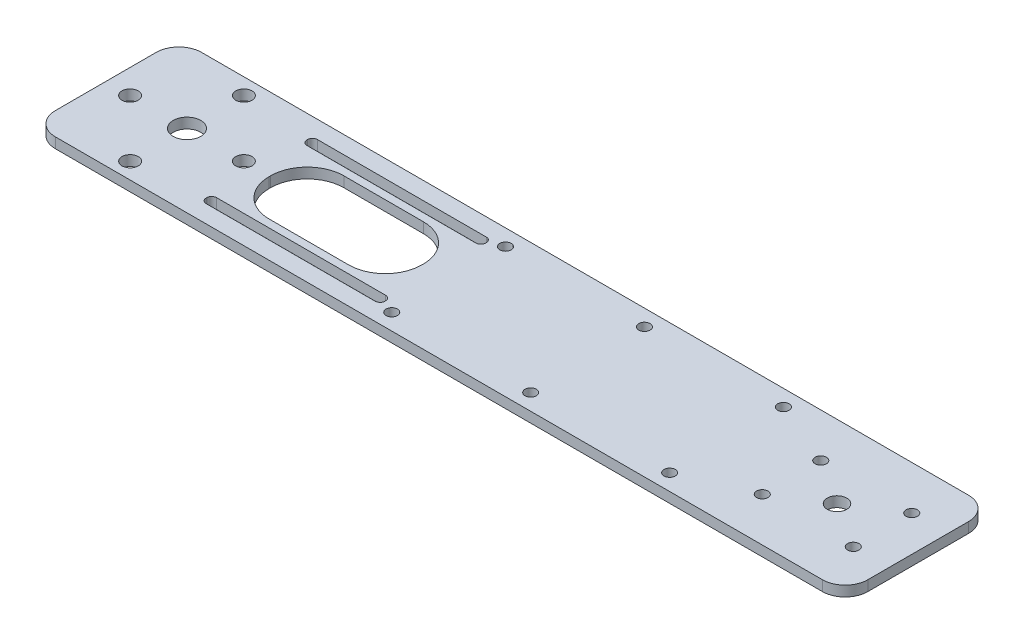
from build123d import *

# Parameters (mm, degrees)
SKETCH1_W           = 250
SKETCH1_H           = 45
BOSS_EXTRUDE1_DEPTH = 3.175
SKETCH4_R           = 3
SKETCH4_R_2         = 1.75
CUT_EXTRUDE1_DEPTH  = 227.144490592
SKETCH5_R           = 4.25
CUT_EXTRUDE2_DEPTH  = 227.144490592
SKETCH6_R           = 11.5
SKETCH6_R_2         = 1.5
CUT_EXTRUDE3_DEPTH  = 227.144490592
SKETCH10_R          = 1.75
CUT_EXTRUDE4_DEPTH  = 227.144490592
FILLET1_R           = 7
SKETCH11_R          = 2.5
CUT_EXTRUDE5_DEPTH  = 227.144490592
CUT_EXTRUDE6_DEPTH  = 227.144490592


with BuildPart() as part:
    # Sketch1 → Boss-Extrude1 (new body)
    with BuildSketch(Plane(origin=(0, 0, 0), x_dir=(1, 0, 0), z_dir=(0, 1, 0))):
        with Locations((100, 0)):
            Rectangle(SKETCH1_W, SKETCH1_H)
    extrude(amount=BOSS_EXTRUDE1_DEPTH)

    # Sketch4 → Cut-Extrude1 (cut, through all)
    with BuildSketch(Plane(origin=(0, 3.175, 0), x_dir=(1, 0, 0), z_dir=(0, 1, 0))):
        with Locations(Location((200, 0, 0), (0, 0, 270))):
            Circle(SKETCH4_R)
        with Locations(Location((186, 9, 0), (0, 0, 270))):
            Circle(SKETCH4_R_2)
        with Locations(Location((214, 9, 0), (0, 0, 90))):
            Circle(SKETCH4_R_2)
        with Locations(Location((214, -9, 0), (0, 0, 270))):
            Circle(SKETCH4_R_2)
        with Locations(Location((186, -9, 0), (0, 0, 90))):
            Circle(SKETCH4_R_2)
    extrude(amount=-CUT_EXTRUDE1_DEPTH, mode=Mode.SUBTRACT)

    # Sketch5 → Cut-Extrude2 (cut, through all)
    with BuildSketch(Plane(origin=(0, 3.175, 0), x_dir=(1, 0, 0), z_dir=(0, 1, 0))):
        with Locations(Location((0, 0, 0), (0, 0, 270))):
            Circle(SKETCH5_R)
    extrude(amount=-CUT_EXTRUDE2_DEPTH, mode=Mode.SUBTRACT)

    # Sketch6 → Cut-Extrude3 (cut, through all)
    with BuildSketch(Plane(origin=(0, 3.175, 0), x_dir=(1, 0, 0), z_dir=(0, 1, 0))):
        with Locations(Location((45, 0, 0), (0, 0, 270))):
            Circle(SKETCH6_R)
        with Locations(Location((29.5, 15.5, 0), (0, 0, 270))):
            Circle(SKETCH6_R_2)
        with Locations(Location((60.5, 15.5, 0), (0, 0, 90))):
            Circle(SKETCH6_R_2)
        with Locations(Location((60.5, -15.5, 0), (0, 0, 270))):
            Circle(SKETCH6_R_2)
        with Locations(Location((29.5, -15.5, 0), (0, 0, 90))):
            Circle(SKETCH6_R_2)
    extrude(amount=-CUT_EXTRUDE3_DEPTH, mode=Mode.SUBTRACT)

    # Sketch10 → Cut-Extrude4 (cut, through all)
    with BuildSketch(Plane(origin=(0, 3.175, 0), x_dir=(1, 0, 0), z_dir=(0, 1, 0))):
        with Locations(Location((80.5, -17.5, 0), (0, 0, 270))):
            Circle(SKETCH10_R)
        with Locations(Location((123.25, -17.5, 0), (0, 0, 270))):
            Circle(SKETCH10_R)
        with Locations(Location((166, -17.5, 0), (0, 0, 270))):
            Circle(SKETCH10_R)
        with Locations(Location((166, 17.5, 0), (0, 0, 90))):
            Circle(SKETCH10_R)
        with Locations(Location((80.5, 17.5, 0), (0, 0, 90))):
            Circle(SKETCH10_R)
        with Locations(Location((123.25, 17.5, 0), (0, 0, 90))):
            Circle(SKETCH10_R)
    extrude(amount=-CUT_EXTRUDE4_DEPTH, mode=Mode.SUBTRACT)

    # Fillet1
    fillet1_edges = [part.edges().sort_by_distance(p)[0] for p in [
        (-25, 1.5875, -22.5),
        (225, 1.5875, -22.5),
        (225, 1.5875, 22.5),
        (-25, 1.5875, 22.5),
    ]]
    fillet(fillet1_edges, radius=FILLET1_R)

    # Sketch11 → Cut-Extrude5 (cut, through all)
    with BuildSketch(Plane(origin=(0, 3.175, 0), x_dir=(1, 0, 0), z_dir=(0, 1, 0))):
        with Locations(Location((0, 17.5, 0), (0, 0, 270))):
            Circle(SKETCH11_R)
        with Locations(Location((17.5, 0, 0), (0, 0, 270))):
            Circle(SKETCH11_R)
        with Locations(Location((0, -17.5, 0), (0, 0, 270))):
            Circle(SKETCH11_R)
        with Locations(Location((-17.5, 0, 0), (0, 0, 270))):
            Circle(SKETCH11_R)
    extrude(amount=-CUT_EXTRUDE5_DEPTH, mode=Mode.SUBTRACT)

    # Sketch12 → Cut-Extrude6 (cut, through all)
    with BuildSketch(Plane(origin=(0, 3.175, 0), x_dir=(1, 0, 0), z_dir=(0, 1, 0))):
        with BuildLine():
            Line((23, 17.1), (75, 17.1))
            ThreePointArc((75, 17.1), (76.060660172, 16.660660172), (76.5, 15.6))
            Line((76.5, 15.6), (76.5, 15.4))
            ThreePointArc((76.5, 15.4), (76.060660172, 14.339339828), (75, 13.9))
            Line((75, 13.9), (23, 13.9))
            ThreePointArc((23, 13.9), (21.939339828, 14.339339828), (21.5, 15.4))
            Line((21.5, 15.4), (21.5, 15.6))
            ThreePointArc((21.5, 15.6), (21.939339828, 16.660660172), (23, 17.1))
        make_face()
        with BuildLine():
            Line((76.5, -15.6), (76.5, -15.4))
            ThreePointArc((76.5, -15.4), (76.060660172, -14.339339828), (75, -13.9))
            Line((75, -13.9), (23, -13.9))
            ThreePointArc((23, -13.9), (21.939339828, -14.339339828), (21.5, -15.4))
            Line((21.5, -15.4), (21.5, -15.6))
            ThreePointArc((21.5, -15.6), (21.939339828, -16.660660172), (23, -17.1))
            Line((23, -17.1), (75, -17.1))
            ThreePointArc((75, -17.1), (76.060660172, -16.660660172), (76.5, -15.6))
        make_face()
        with BuildLine():
            Line((36.75, 11.5), (61.25, 11.5))
            ThreePointArc((61.25, 11.5), (69.204951288, 8.204951288), (72.5, 0.25))
            Line((72.5, 0.25), (72.5, -0.25))
            ThreePointArc((72.5, -0.25), (69.204951288, -8.204951288), (61.25, -11.5))
            Line((61.25, -11.5), (36.75, -11.5))
            ThreePointArc((36.75, -11.5), (28.795048712, -8.204951288), (25.5, -0.25))
            Line((25.5, -0.25), (25.5, 0.25))
            ThreePointArc((25.5, 0.25), (28.795048712, 8.204951288), (36.75, 11.5))
        make_face()
    extrude(amount=-CUT_EXTRUDE6_DEPTH, mode=Mode.SUBTRACT)


solid = part.part
